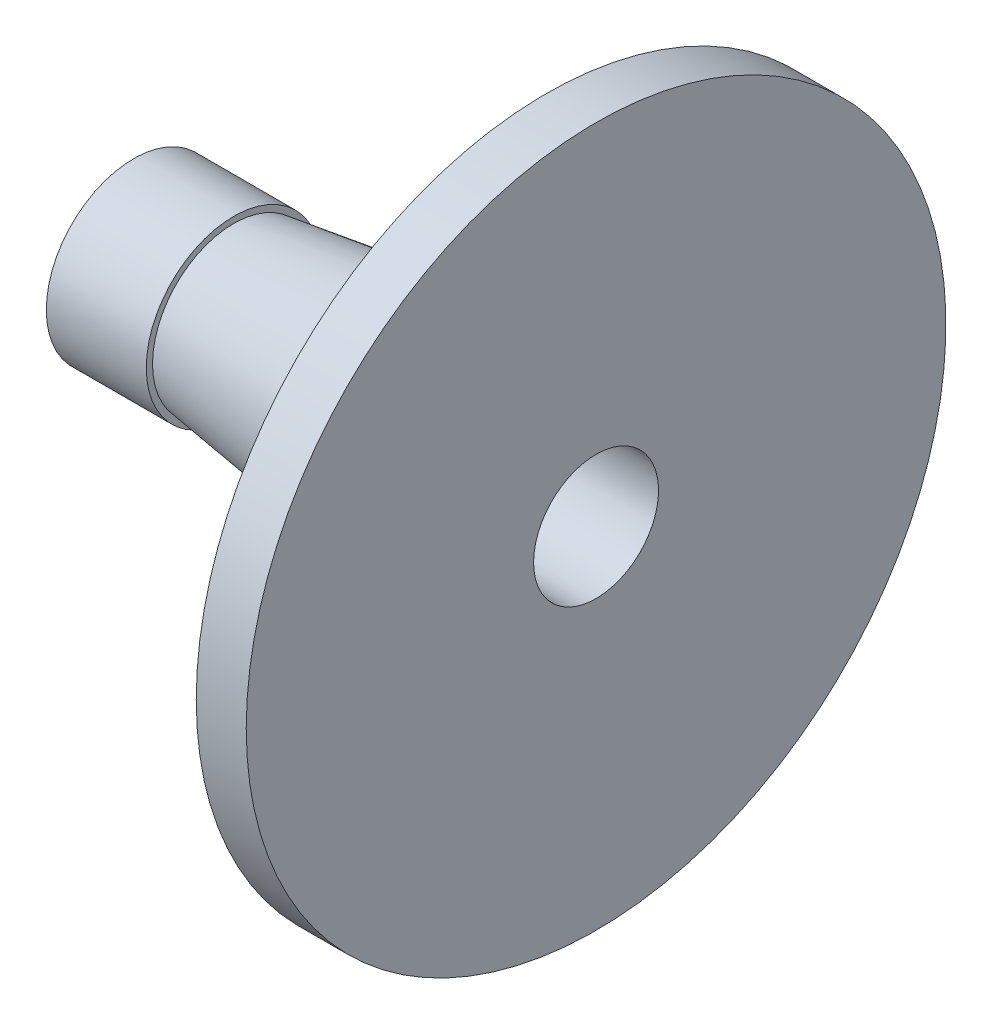
from build123d import *


with BuildPart() as part:
    # Sketch1 → Revolve1 (revolve)
    with BuildSketch(Plane.XY, mode=Mode.PRIVATE) as revolve1_sk:
        Polygon((185, 25), (185, 140), (165, 140), (165, 50), (40, 32.5), (40, 35), (0, 35), (0, 25), align=None)
    revolve(revolve1_sk.sketch.rotate(Axis((0, 0, 0), (1, 0, 0)), 90), axis=Axis((0, 0, 0), (1, 0, 0)))


solid = part.part
